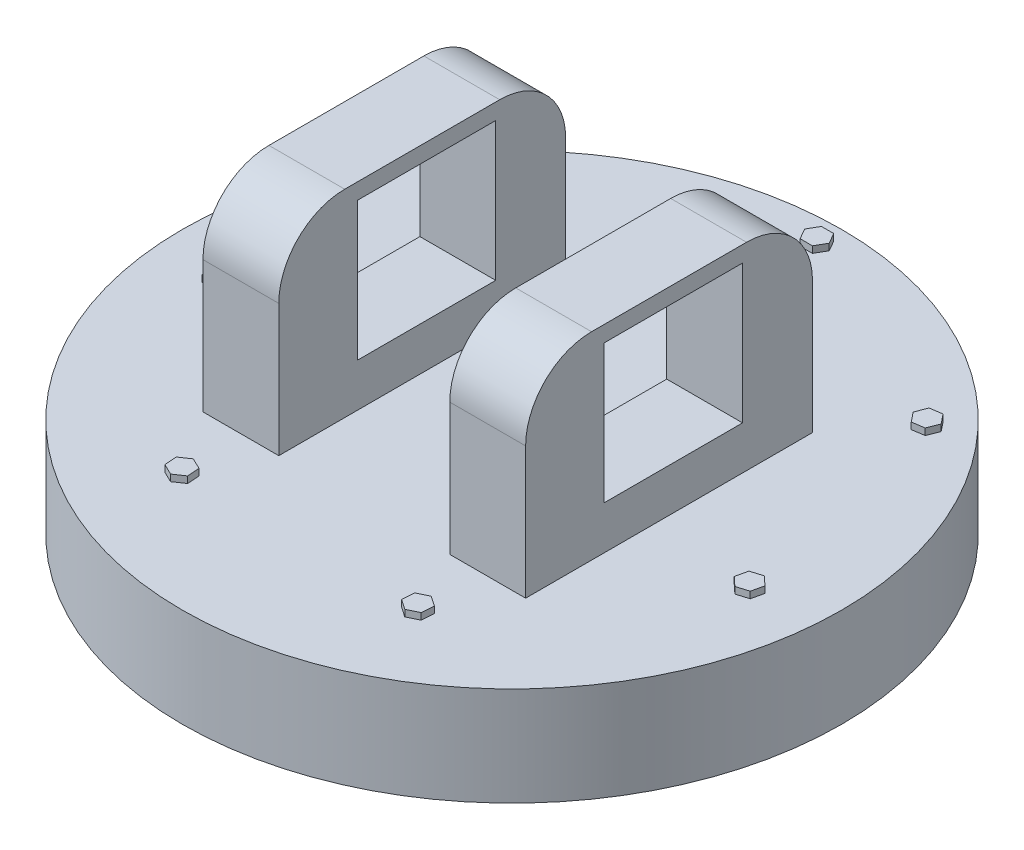
from build123d import *

# Parameters (mm, degrees)
Y_KSEKLIK_EKSTR_ZYON1_DEPTH      = 10
Y_KSEKLIK_EKSTR_ZYON1_DEPTH_BACK = 20
IZIM1_R                          = 100
IZIM4_R                          = 2.55
KES_EKSTR_ZYON4_DEPTH            = 20.2
IZIM8_W                          = 23
IZIM8_H                          = 87
Y_KSEKLIK_EKSTR_ZYON5_DEPTH      = 70
KES_EKSTR_ZYON6_DEPTH            = 60
KES_EKSTR_ZYON6_DEPTH_BACK       = 60
IZIM9_W                          = 42
IZIM9_H                          = 42
Y_KSEKLIK_EKSTR_ZYON6_DEPTH      = 2
RADYUS1_R                        = 20


with BuildPart() as part:
    # Çizim1 → Yükseklik-Ekstrüzyon1 (new, two sides: drawn at the far end of the back side and taken through both)
    with BuildSketch(Plane(origin=(0, 0, 0), x_dir=(1, 0, 0), z_dir=(0, 1, 0)).offset(-Y_KSEKLIK_EKSTR_ZYON1_DEPTH_BACK)):
        with Locations(Location((0, 0, 0), (0, 0, 270))):
            Circle(IZIM1_R)
    extrude(amount=Y_KSEKLIK_EKSTR_ZYON1_DEPTH + Y_KSEKLIK_EKSTR_ZYON1_DEPTH_BACK)

    # Çizim4 → Kes-Ekstrüzyon4 (cut)
    with BuildSketch(Plane(origin=(0, 0, 0), x_dir=(1, 0, 0), z_dir=(0, 1, 0))):
        with Locations(Location((0, 0, 0), (0, 0, 270))):
            Circle(IZIM4_R)
    extrude(amount=-KES_EKSTR_ZYON4_DEPTH, mode=Mode.SUBTRACT)

    # Çizim8 → Yükseklik-Ekstrüzyon5 (add)
    with BuildSketch(Plane(origin=(0, 0, 0), x_dir=(1, 0, 0), z_dir=(0, 1, 0))):
        with Locations((-37.434640227, -1.29867582)):
            Rectangle(IZIM8_W, IZIM8_H)
        with Locations((37.434640227, -1.29867582)):
            Rectangle(IZIM8_W, IZIM8_H)
    extrude(amount=Y_KSEKLIK_EKSTR_ZYON5_DEPTH)

    # Çizim9 → Kes-Ekstrüzyon6 (cut, two sides: drawn at the far end of the back side and taken through both)
    with BuildSketch(Plane(origin=(0, 0, 0), x_dir=(0, 0, -1), z_dir=(1, 0, 0)).offset(-KES_EKSTR_ZYON6_DEPTH_BACK)):
        with Locations((0, 44.15078082)):
            Rectangle(IZIM9_W, IZIM9_H)
    extrude(amount=KES_EKSTR_ZYON6_DEPTH + KES_EKSTR_ZYON6_DEPTH_BACK, mode=Mode.SUBTRACT)

    # Çizim10 → Yükseklik-Ekstrüzyon6 (add)
    with BuildSketch(Plane(origin=(0, 10, 0), x_dir=(1, 0, 0), z_dir=(0, 1, 0))):
        Polygon((66.812616777, 58.515280774), (68.173954633, 61.983913061), (65.850699884, 64.897182371), (62.166107279, 64.341819393), (60.804769424, 60.873187106), (63.128024173, 57.959917797), align=None)
        Polygon((3.726211306, 92.48499002), (1.863105653, 95.711983671), (-1.863105653, 95.711983671), (-3.726211306, 92.48499002), (-1.863105653, 89.257996369), (1.863105653, 89.257996369), align=None)
        Polygon((79.587759086, -11.987424426), (83.148425279, -10.889104362), (83.977585299, -7.256316953), (81.246079126, -4.721849607), (77.685412933, -5.820169671), (76.856252913, -9.45295708), align=None)
        Polygon((32.431695509, -65.933150571), (35.510435771, -68.032200141), (38.867636153, -66.415457646), (39.146096273, -62.699665583), (36.06735601, -60.600616013), (32.710155628, -62.217358508), align=None)
        Polygon((-39.146096273, -62.699665583), (-38.867636153, -66.415457646), (-35.510435771, -68.032200141), (-32.431695509, -65.933150571), (-32.710155628, -62.217358508), (-36.06735601, -60.600616013), align=None)
        Polygon((-81.246079126, -4.721849607), (-83.977585299, -7.256316953), (-83.148425279, -10.889104362), (-79.587759086, -11.987424426), (-76.856252913, -9.45295708), (-77.685412933, -5.820169671), align=None)
        Polygon((-62.166107279, 64.341819393), (-65.850699884, 64.89718237), (-68.173954633, 61.983913061), (-66.812616777, 58.515280774), (-63.128024173, 57.959917797), (-60.804769424, 60.873187106), align=None)
    extrude(amount=Y_KSEKLIK_EKSTR_ZYON6_DEPTH)

    # Radyus1
    radyus1_edges = [part.edges().sort_by_distance(p)[0] for p in [
        (-37.434640227, 70, -42.20132418),
        (-37.434640227, 70, 44.79867582),
        (37.434640227, 70, -42.20132418),
        (37.434640227, 70, 44.79867582),
    ]]
    fillet(radyus1_edges, radius=RADYUS1_R)


solid = part.part
